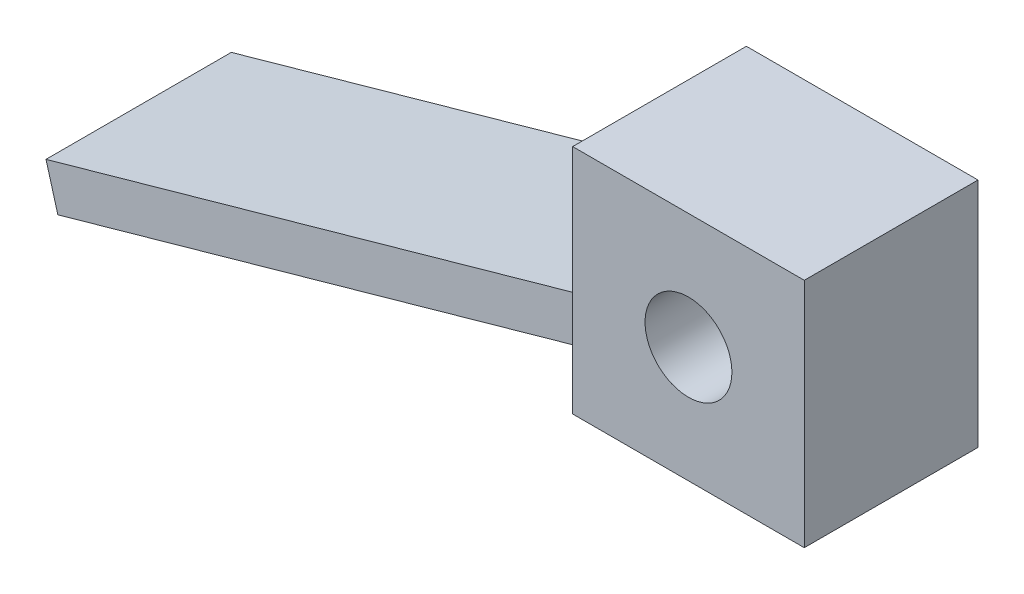
from build123d import *

# Parameters (mm, degrees)
CROQUIS1_W              = 40
CROQUIS1_H              = 40
SALIENTE_EXTRUIR1_DEPTH = 30
CROQUIS2_R              = 7.5
CORTAR_EXTRUIR1_DEPTH   = 30
SALIENTE_EXTRUIR2_DEPTH = 60
CORTAR_EXTRUIR2_DEPTH   = 28
CROQUIS5_W              = 30
CROQUIS5_H              = 32
SALIENTE_EXTRUIR3_DEPTH = 7.555544
CROQUIS6_W              = 20
CROQUIS6_H              = 32
SALIENTE_EXTRUIR4_DEPTH = 7.555546


with BuildPart() as part:
    # Croquis1 → Saliente-Extruir1 (new body)
    with BuildSketch(Plane.XY):
        with Locations((20, 20)):
            Rectangle(CROQUIS1_W, CROQUIS1_H)
    extrude(amount=SALIENTE_EXTRUIR1_DEPTH)

    # Croquis2 → Cortar-Extruir1 (cut)
    with BuildSketch(Plane.XY.offset(30)):
        with Locations((20, 20)):
            Circle(CROQUIS2_R)
    extrude(amount=-CORTAR_EXTRUIR1_DEPTH, mode=Mode.SUBTRACT)

    # Croquis3 → Saliente-Extruir2 (add)
    with BuildSketch(Plane.XY.offset(30)):
        Polygon((1.49506347, 0), (9.49506347, 0), (-0.374188302, -9.869251771), (-68.777675608, -29.117470727), (-70.824265709, -21.844387418), (-0.374188302, -2.020273637), align=None)
    extrude(amount=-SALIENTE_EXTRUIR2_DEPTH)

    # Croquis4 → Cortar-Extruir2 (cut)
    with BuildSketch(Plane.XY.offset(30)):
        Polygon((-70.824265709, -21.844387418), (-68.777675608, -29.117470727), (-0.374188302, -9.869251771), (9.49506347, 0), (1.49506347, 0), (-0.374188302, -2.020273637), align=None)
    extrude(amount=-CORTAR_EXTRUIR2_DEPTH, mode=Mode.SUBTRACT)

    # Croquis5 → Saliente-Extruir3 (add)
    with BuildSketch(Plane(origin=(2.545913561, -9.047557407, 0), x_dir=(0.9626152142655234, 0.2708725701589966, 0), z_dir=(0.2708725701589965, -0.9626152142655233, 0))):
        with Locations((-89.093561074, -14)):
            Rectangle(CROQUIS5_W, CROQUIS5_H)
    extrude(amount=-SALIENTE_EXTRUIR3_DEPTH)

    # Croquis6 → Saliente-Extruir4 (add)
    with BuildSketch(Plane(origin=(2.545913561, -9.047557407, 0), x_dir=(0.9626152142655234, 0.2708725701589966, 0), z_dir=(0.2708725701589965, -0.9626152142655233, 0))):
        with Locations((-114.093561074, -14)):
            Rectangle(CROQUIS6_W, CROQUIS6_H)
    extrude(amount=-SALIENTE_EXTRUIR4_DEPTH)


solid = part.part
